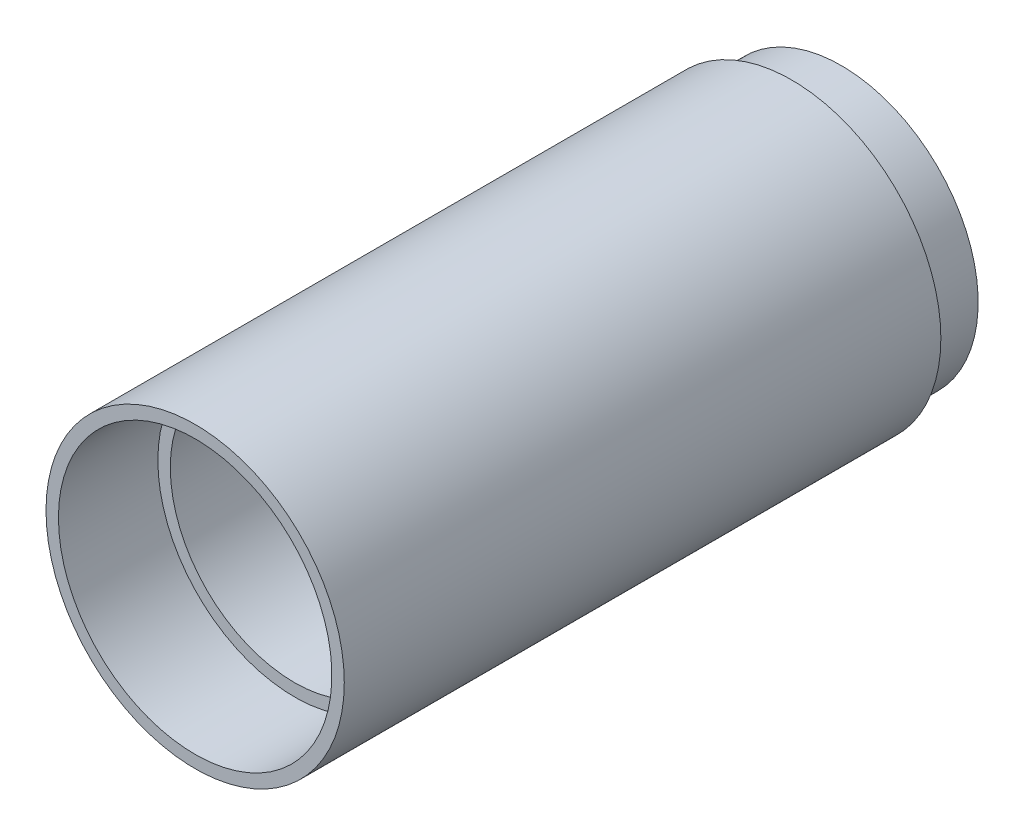
from build123d import *

# Parameters (mm, degrees)
SKETCH_2_R          = 60
EXTRUDE_1_DEPTH     = 200
SKETCH_3_R          = 50
CUT_EXTRUDE_1_DEPTH = 200
EXTRUDE_START       = 20
SKETCH_4_R          = 55
SKETCH_4_R_2        = 50
EXTRUDE_2_DEPTH     = 20
SKETCH_5_R          = 60
SKETCH_5_R_2        = 55
EXTRUDE_3_DEPTH     = 40


with BuildPart() as part:
    # 草图2 → 凸台-拉伸1 (new body)
    with BuildSketch(Plane.XY):
        with Locations((-112.606133367, 79.56790028)):
            Circle(SKETCH_2_R)
    extrude(amount=EXTRUDE_1_DEPTH)

    # 草图3 → 切除-拉伸1 (cut)
    with BuildSketch(Plane(origin=(0, 0, 0), x_dir=(-1, 0, 0), z_dir=(0, 0, -1))):
        with Locations((112.606133367, 79.56790028)):
            Circle(SKETCH_3_R)
    extrude(amount=-CUT_EXTRUDE_1_DEPTH, mode=Mode.SUBTRACT)

    # 草图4 → 凸台-拉伸2 (add)
    with BuildSketch(Plane(origin=(0, 0, 0), x_dir=(-1, 0, 0), z_dir=(0, 0, -1)).offset(EXTRUDE_START)):
        with Locations((112.606133367, 79.56790028)):
            Circle(SKETCH_4_R)
        with Locations((112.606133367, 79.56790028)):
            Circle(SKETCH_4_R_2, mode=Mode.SUBTRACT)
    extrude(amount=-EXTRUDE_2_DEPTH)

    # 草图5 → 凸台-拉伸3 (add)
    with BuildSketch(Plane.XY.offset(200)):
        with Locations((-112.606133367, 79.56790028)):
            Circle(SKETCH_5_R)
        with Locations(Location((-112.606133367, 79.56790028, 0), (0, 0, 180))):
            Circle(SKETCH_5_R_2, mode=Mode.SUBTRACT)
    extrude(amount=EXTRUDE_3_DEPTH)


solid = part.part
